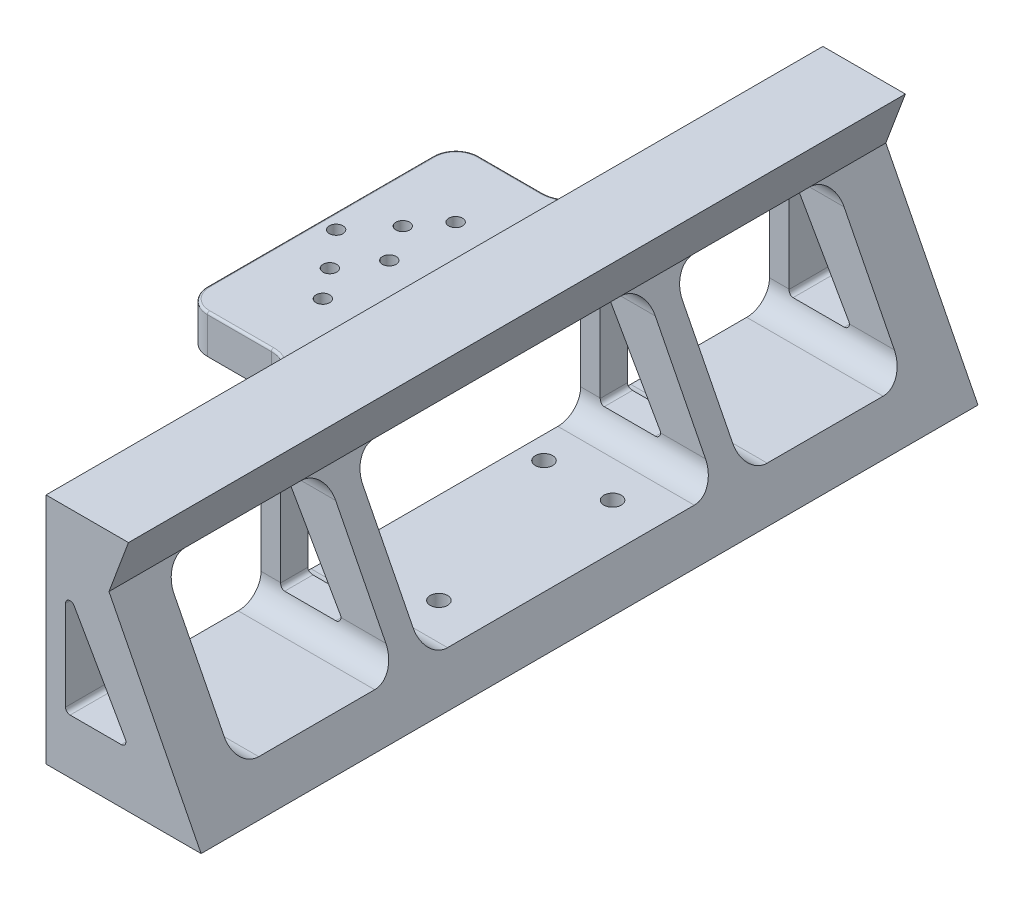
from build123d import *

# Parameters (mm, degrees)
EXTRUDE_1_DEPTH          = 85
SKETCH_2_W               = 59.36627173602581
SKETCH_2_H               = 8.418969471425655
EXTRUDE_2_DEPTH          = 25
FILLET_1_R               = 6
FILLET_2_R               = 5
CUT_EXTRUDE_1_REACH      = 117.911
SKETCH_4_R               = 1.499999999999997
SKETCH_7_W               = 35.37461908353682
SKETCH_7_H               = 31.585915090625495
CUT_EXTRUDE_2_DEPTH      = 123.13645897424483
FILLET_3_R               = 5
FILLET_4_R               = 0.5
CUT_EXTRUDE_3_DEPTH      = 192.29117767705227
CUT_EXTRUDE_3_DEPTH_BACK = 192.29117767705227
SKETCH_9_R               = 1.8999999999999981
CUT_EXTRUDE_4_DEPTH      = 27.999999999999996


with BuildPart() as part:
    # 草图1 → 凸台-拉伸1 (new, symmetric)
    with BuildSketch(Plane.XY):
        Polygon((-37.5, 10.529999999999998), (-3.5592322501332707, 10.529999999999998), (-8.298471778986107, 19.8329163418583), (-23.723742156818243, 50.11203580857437), (-19.449282757937613, 61.53100528), (-37.5, 61.53100528), align=None)
    extrude(amount=EXTRUDE_1_DEPTH, both=True)

    # 草图2 → 凸台-拉伸2 (add)
    with BuildSketch(Plane.ZY.offset(37.5)):
        with Locations((0, 54.32152054428719)):
            Rectangle(SKETCH_2_W, SKETCH_2_H)
    extrude(amount=EXTRUDE_2_DEPTH)

    # 圆角1
    fillet_1_edges = [part.edges().sort_by_distance(p)[0] for p in [
        (-37.5, 54.32152054428719, -29.683135868012904),
        (-37.5, 54.32152054428719, 29.683135868012904),
    ]]
    fillet(fillet_1_edges, radius=FILLET_1_R)

    # 圆角2
    fillet_2_edges = [part.edges().sort_by_distance(p)[0] for p in [
        (-62.5, 54.32152054428719, -29.683135868012904),
        (-62.5, 54.32152054428719, 29.683135868012904),
    ]]
    fillet(fillet_2_edges, radius=FILLET_2_R)

    # 草图4 → 切除-拉伸1 (cut, up to next)
    with BuildSketch(Plane(origin=(0, 58.53100528000001, 0), x_dir=(1, 0, 0), z_dir=(0, 1, 0)), mode=Mode.PRIVATE) as cut_extrude_1_sk1:
        with Locations(Location((-47.387450092880144, 14.526154223892442, 0), (0, 0, 270))):
            Circle(SKETCH_4_R)
    cut_extrude_1_tool1 = extrude(cut_extrude_1_sk1.sketch, amount=-CUT_EXTRUDE_1_REACH, mode=Mode.PRIVATE) & part.part
    # 草图4 → 切除-拉伸1 (cut, up to next)
    with BuildSketch(Plane(origin=(0, 58.53100528000001, 0), x_dir=(1, 0, 0), z_dir=(0, 1, 0)), mode=Mode.PRIVATE) as cut_extrude_1_sk2:
        with Locations(Location((-52.407927387117596, 7.976309366063233, 0), (0, 0, 270))):
            Circle(SKETCH_4_R)
    cut_extrude_1_tool2 = extrude(cut_extrude_1_sk2.sketch, amount=-CUT_EXTRUDE_1_REACH, mode=Mode.PRIVATE) & part.part
    # 草图4 → 切除-拉伸1 (cut, up to next)
    with BuildSketch(Plane(origin=(0, 58.53100528000001, 0), x_dir=(1, 0, 0), z_dir=(0, 1, 0)), mode=Mode.PRIVATE) as cut_extrude_1_sk3:
        with Locations(Location((-59.01827910600927, -2.429e-14, 0), (0, 0, 270))):
            Circle(SKETCH_4_R)
    cut_extrude_1_tool3 = extrude(cut_extrude_1_sk3.sketch, amount=-CUT_EXTRUDE_1_REACH, mode=Mode.PRIVATE) & part.part
    # 草图4 → 切除-拉伸1 (cut, up to next)
    with BuildSketch(Plane(origin=(0, 58.53100528000001, 0), x_dir=(1, 0, 0), z_dir=(0, 1, 0)), mode=Mode.PRIVATE) as cut_extrude_1_sk4:
        with Locations(Location((-47.387450092880144, -2.456e-14, 0), (0, 0, 270))):
            Circle(SKETCH_4_R)
    cut_extrude_1_tool4 = extrude(cut_extrude_1_sk4.sketch, amount=-CUT_EXTRUDE_1_REACH, mode=Mode.PRIVATE) & part.part
    # 草图4 → 切除-拉伸1 (cut, up to next)
    with BuildSketch(Plane(origin=(0, 58.53100528000001, 0), x_dir=(1, 0, 0), z_dir=(0, 1, 0)), mode=Mode.PRIVATE) as cut_extrude_1_sk5:
        with Locations(Location((-52.407927387117596, -7.976309366063282, 0), (0, 0, 270))):
            Circle(SKETCH_4_R)
    cut_extrude_1_tool5 = extrude(cut_extrude_1_sk5.sketch, amount=-CUT_EXTRUDE_1_REACH, mode=Mode.PRIVATE) & part.part
    # 草图4 → 切除-拉伸1 (cut, up to next)
    with BuildSketch(Plane(origin=(0, 58.53100528000001, 0), x_dir=(1, 0, 0), z_dir=(0, 1, 0)), mode=Mode.PRIVATE) as cut_extrude_1_sk6:
        with Locations(Location((-47.387450092880144, -14.52615422389249, 0), (0, 0, 270))):
            Circle(SKETCH_4_R)
    cut_extrude_1_tool6 = extrude(cut_extrude_1_sk6.sketch, amount=-CUT_EXTRUDE_1_REACH, mode=Mode.PRIVATE) & part.part
    add(cut_extrude_1_tool1.solids().sort_by_distance((-47.38745, 58.531005, -14.526154))[0], mode=Mode.SUBTRACT)
    add(cut_extrude_1_tool2.solids().sort_by_distance((-52.407927, 58.531005, -7.976309))[0], mode=Mode.SUBTRACT)
    add(cut_extrude_1_tool3.solids().sort_by_distance((-59.018279, 58.531005, 0))[0], mode=Mode.SUBTRACT)
    add(cut_extrude_1_tool4.solids().sort_by_distance((-47.38745, 58.531005, 0))[0], mode=Mode.SUBTRACT)
    add(cut_extrude_1_tool5.solids().sort_by_distance((-52.407927, 58.531005, 7.976309))[0], mode=Mode.SUBTRACT)
    add(cut_extrude_1_tool6.solids().sort_by_distance((-47.38745, 58.531005, 14.526154))[0], mode=Mode.SUBTRACT)

    # 草图7 → 切除-拉伸2 (cut, through all)
    with BuildSketch(Plane(origin=(0, 0, 0), x_dir=(0, 0, -1), z_dir=(1, 0, 0))):
        Polygon((31.999178331290963, 50.11203580857436), (-31.999178331290963, 50.11203580857436), (-31.999178331290956, 18.526120717948867), (31.999178331290956, 18.526120717948867), align=None)
        with Locations((55.6272635970121, 34.319078263261616)):
            Rectangle(SKETCH_7_W, SKETCH_7_H)
        with Locations((-55.6272635970121, 34.319078263261616)):
            Rectangle(SKETCH_7_W, SKETCH_7_H)
    extrude(amount=-CUT_EXTRUDE_2_DEPTH, mode=Mode.SUBTRACT)

    # 圆角3
    fillet_3_edges = [part.edges().sort_by_distance(p)[0] for p in [
        (-22.56637158923609, 18.526120717948867, -37.939954055243696),
        (-30.611871078409123, 50.11203580857436, -73.31457313878052),
        (-22.56637158923609, 18.526120717948867, -73.31457313878052),
        (-30.611871078409123, 50.11203580857437, -37.939954055243696),
        (-30.611871078409123, 50.11203580857437, 37.939954055243696),
        (-22.56637158923609, 18.526120717948867, 37.939954055243696),
        (-22.56637158923609, 18.526120717948867, 73.31457313878052),
        (-30.611871078409123, 50.11203580857436, 73.31457313878052),
        (-22.56637158923609, 18.526120717948867, -31.999178331290956),
        (-30.611871078409123, 50.11203580857436, -31.999178331290963),
        (-22.56637158923609, 18.526120717948867, 31.999178331290956),
        (-30.611871078409123, 50.11203580857436, 31.999178331290963),
    ]]
    fillet(fillet_3_edges, radius=FILLET_3_R)

    # 圆角4
    fillet_4_edges = [part.edges().sort_by_distance(p)[0] for p in [
        (-39.257359312880716, 58.53100528000001, 31.44049518089362),
        (-39.257359312880716, 58.53100528000001, -31.44049518089362),
        (-62.5, 58.53100528000001, 0),
        (-50.5, 58.53100528000001, -29.683135868012904),
        (-50.5, 58.53100528000001, 29.683135868012904),
        (-61.03553390593274, 58.53100528000001, -28.218669773945642),
        (-61.03553390593274, 58.53100528000001, 28.218669773945642),
    ]]
    fillet(fillet_4_edges, radius=FILLET_4_R)

    # 草图8 → 切除-拉伸3 (cut, two sides: drawn at the far end of the back side and taken through both)
    with BuildSketch(Plane.XY.offset(85).offset(-CUT_EXTRUDE_3_DEPTH_BACK)):
        with BuildLine():
            Line((-32.222504901358434, 22.456484131426393), (-21.015514746320488, 22.456484131426393))
            ThreePointArc((-21.015514746320488, 22.456484131426393), (-20.15092452706273, 22.954006517234653), (-20.146640285068184, 23.951516625898744))
            Line((-20.146640285068184, 23.951516625898744), (-31.353630440106134, 43.6218769395131))
            ThreePointArc((-31.353630440106134, 43.6218769395131), (-32.47855717995374, 44.09350738041489), (-33.222504901358434, 43.12684444504075))
            Line((-33.222504901358434, 43.12684444504075), (-33.222504901358434, 23.456484131426393))
            ThreePointArc((-33.222504901358434, 23.456484131426393), (-32.92961168254498, 22.749377350239847), (-32.222504901358434, 22.456484131426393))
        make_face()
    extrude(amount=CUT_EXTRUDE_3_DEPTH + CUT_EXTRUDE_3_DEPTH_BACK, mode=Mode.SUBTRACT)

    # 草图9 → 切除-拉伸4 (cut)
    with BuildSketch(Plane(origin=(0, 18.526120717948867, 0), x_dir=(1, 0, 0), z_dir=(0, 1, 0))):
        with Locations(Location((-32.52765590256421, -19, 0), (0, 0, 270))):
            Circle(SKETCH_9_R)
        with Locations(Location((-32.52765590256421, 19, 0), (0, 0, 270))):
            Circle(SKETCH_9_R)
        with Locations(Location((-17.527655902564213, 19, 0), (0, 0, 270))):
            Circle(SKETCH_9_R)
        with Locations(Location((-17.527655902564213, -19, 0), (0, 0, 270))):
            Circle(SKETCH_9_R)
    extrude(amount=-CUT_EXTRUDE_4_DEPTH, mode=Mode.SUBTRACT)


solid = part.part
